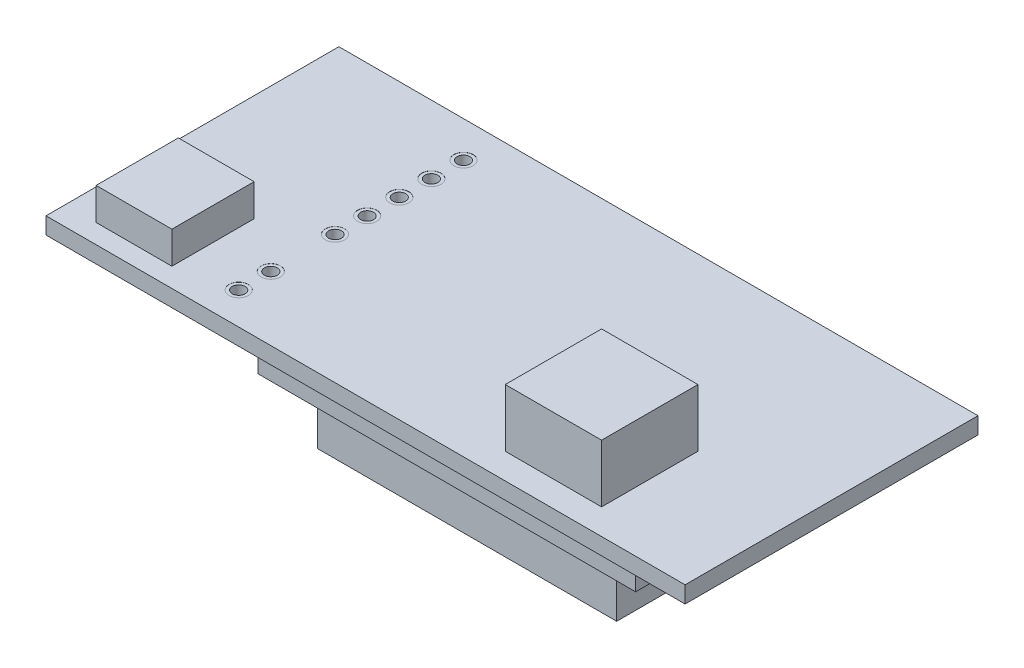
from build123d import *

# Parameters (mm, degrees)
SKETCH1_W           = 49.75
SKETCH1_H           = 22.8
BOSS_EXTRUDE1_DEPTH = 1.3
SKETCH2_W           = 7.5
SKETCH2_H           = 7.5
BOSS_EXTRUDE2_DEPTH = 4.5
SKETCH3_W           = 5.9
SKETCH3_H           = 6.4
BOSS_EXTRUDE3_DEPTH = 2.5
SKETCH4_W           = 29.4
SKETCH4_H           = 21.1
BOSS_EXTRUDE4_DEPTH = 1.95
SKETCH5_W           = 23.3
SKETCH5_H           = 20.25
BOSS_EXTRUDE5_DEPTH = 3.15
CUT_EXTRUDE1_REACH  = 29.971
SKETCH6_R           = 0.5
SKETCH7_R           = 0.75
CUT_EXTRUDE2_DEPTH  = 0.01
CUT_EXTRUDE3_START  = -0.01
SKETCH8_R           = 0.75
CUT_EXTRUDE3_DEPTH  = 0.01


with BuildPart() as part:
    # Sketch1 → Boss-Extrude1 (new body)
    with BuildSketch(Plane(origin=(0, 0, 0), x_dir=(1, 0, 0), z_dir=(0, 1, 0))):
        Rectangle(SKETCH1_W, SKETCH1_H)
    extrude(amount=BOSS_EXTRUDE1_DEPTH)

    # Sketch2 → Boss-Extrude2 (add)
    with BuildSketch(Plane(origin=(0, 1.3, 0), x_dir=(1, 0, 0), z_dir=(0, 1, 0))):
        with Locations((12.625, -5.65)):
            Rectangle(SKETCH2_W, SKETCH2_H)
    extrude(amount=BOSS_EXTRUDE2_DEPTH)

    # Sketch3 → Boss-Extrude3 (add)
    with BuildSketch(Plane(origin=(0, 1.3, 0), x_dir=(1, 0, 0), z_dir=(0, 1, 0))):
        with Locations((-19.525, -6.7)):
            Rectangle(SKETCH3_W, SKETCH3_H)
    extrude(amount=BOSS_EXTRUDE3_DEPTH)

    # Sketch4 → Boss-Extrude4 (add)
    with BuildSketch(Plane.XZ):
        with Locations((5.475, 0)):
            Rectangle(SKETCH4_W, SKETCH4_H)
    extrude(amount=BOSS_EXTRUDE4_DEPTH)

    # Sketch5 → Boss-Extrude5 (add)
    with BuildSketch(Plane.XZ.offset(1.95)):
        with Locations((6.625, 0)):
            Rectangle(SKETCH5_W, SKETCH5_H)
    extrude(amount=BOSS_EXTRUDE5_DEPTH)

    # Sketch6 → Cut-Extrude1 (cut, up to next)
    with BuildSketch(Plane.XZ, mode=Mode.PRIVATE) as cut_extrude1_sk1:
        with Locations(Location((-12.375, 8.9, 0), (0, 0, 270))):
            Circle(SKETCH6_R)
    cut_extrude1_tool1 = extrude(cut_extrude1_sk1.sketch, amount=-CUT_EXTRUDE1_REACH, mode=Mode.PRIVATE) & part.part
    # Sketch6 → Cut-Extrude1 (cut, up to next)
    with BuildSketch(Plane.XZ, mode=Mode.PRIVATE) as cut_extrude1_sk2:
        with Locations(Location((-12.375, 6.4, 0), (0, 0, 270))):
            Circle(SKETCH6_R)
    cut_extrude1_tool2 = extrude(cut_extrude1_sk2.sketch, amount=-CUT_EXTRUDE1_REACH, mode=Mode.PRIVATE) & part.part
    # Sketch6 → Cut-Extrude1 (cut, up to next)
    with BuildSketch(Plane.XZ, mode=Mode.PRIVATE) as cut_extrude1_sk3:
        with Locations(Location((-12.375, 1.4, 0), (0, 0, 270))):
            Circle(SKETCH6_R)
    cut_extrude1_tool3 = extrude(cut_extrude1_sk3.sketch, amount=-CUT_EXTRUDE1_REACH, mode=Mode.PRIVATE) & part.part
    # Sketch6 → Cut-Extrude1 (cut, up to next)
    with BuildSketch(Plane.XZ, mode=Mode.PRIVATE) as cut_extrude1_sk4:
        with Locations(Location((-12.375, -1.1, 0), (0, 0, 270))):
            Circle(SKETCH6_R)
    cut_extrude1_tool4 = extrude(cut_extrude1_sk4.sketch, amount=-CUT_EXTRUDE1_REACH, mode=Mode.PRIVATE) & part.part
    # Sketch6 → Cut-Extrude1 (cut, up to next)
    with BuildSketch(Plane.XZ, mode=Mode.PRIVATE) as cut_extrude1_sk5:
        with Locations(Location((-12.375, -3.6, 0), (0, 0, 270))):
            Circle(SKETCH6_R)
    cut_extrude1_tool5 = extrude(cut_extrude1_sk5.sketch, amount=-CUT_EXTRUDE1_REACH, mode=Mode.PRIVATE) & part.part
    # Sketch6 → Cut-Extrude1 (cut, up to next)
    with BuildSketch(Plane.XZ, mode=Mode.PRIVATE) as cut_extrude1_sk6:
        with Locations(Location((-12.375, -6.1, 0), (0, 0, 270))):
            Circle(SKETCH6_R)
    cut_extrude1_tool6 = extrude(cut_extrude1_sk6.sketch, amount=-CUT_EXTRUDE1_REACH, mode=Mode.PRIVATE) & part.part
    # Sketch6 → Cut-Extrude1 (cut, up to next)
    with BuildSketch(Plane.XZ, mode=Mode.PRIVATE) as cut_extrude1_sk7:
        with Locations(Location((-12.375, -8.6, 0), (0, 0, 270))):
            Circle(SKETCH6_R)
    cut_extrude1_tool7 = extrude(cut_extrude1_sk7.sketch, amount=-CUT_EXTRUDE1_REACH, mode=Mode.PRIVATE) & part.part
    add(cut_extrude1_tool1.solids().sort_by_distance((-12.375, 0, 8.9))[0], mode=Mode.SUBTRACT)
    add(cut_extrude1_tool2.solids().sort_by_distance((-12.375, 0, 6.4))[0], mode=Mode.SUBTRACT)
    add(cut_extrude1_tool3.solids().sort_by_distance((-12.375, 0, 1.4))[0], mode=Mode.SUBTRACT)
    add(cut_extrude1_tool4.solids().sort_by_distance((-12.375, 0, -1.1))[0], mode=Mode.SUBTRACT)
    add(cut_extrude1_tool5.solids().sort_by_distance((-12.375, 0, -3.6))[0], mode=Mode.SUBTRACT)
    add(cut_extrude1_tool6.solids().sort_by_distance((-12.375, 0, -6.1))[0], mode=Mode.SUBTRACT)
    add(cut_extrude1_tool7.solids().sort_by_distance((-12.375, 0, -8.6))[0], mode=Mode.SUBTRACT)

    # Sketch7 → Cut-Extrude2 (cut)
    with BuildSketch(Plane.XZ):
        with Locations(Location((-12.375, 8.9, 0), (0, 0, 270))):
            Circle(SKETCH7_R)
        with Locations(Location((-12.375, 6.4, 0), (0, 0, 270))):
            Circle(SKETCH7_R)
        with Locations(Location((-12.375, 1.4, 0), (0, 0, 270))):
            Circle(SKETCH7_R)
        with Locations(Location((-12.375, -1.1, 0), (0, 0, 270))):
            Circle(SKETCH7_R)
        with Locations(Location((-12.375, -3.6, 0), (0, 0, 270))):
            Circle(SKETCH7_R)
        with Locations(Location((-12.375, -6.1, 0), (0, 0, 270))):
            Circle(SKETCH7_R)
        with Locations(Location((-12.375, -8.6, 0), (0, 0, 270))):
            Circle(SKETCH7_R)
    extrude(amount=-CUT_EXTRUDE2_DEPTH, mode=Mode.SUBTRACT)

    # Sketch8 → Cut-Extrude3 (cut)
    with BuildSketch(Plane(origin=(0, 1.3, 0), x_dir=(1, 0, 0), z_dir=(0, 1, 0)).offset(CUT_EXTRUDE3_START)):
        with Locations(Location((-12.375, 8.6, 0), (0, 0, 90))):
            Circle(SKETCH8_R)
        with Locations(Location((-12.375, 6.1, 0), (0, 0, 90))):
            Circle(SKETCH8_R)
        with Locations(Location((-12.375, 3.6, 0), (0, 0, 90))):
            Circle(SKETCH8_R)
        with Locations(Location((-12.375, 1.1, 0), (0, 0, 90))):
            Circle(SKETCH8_R)
        with Locations(Location((-12.375, -1.4, 0), (0, 0, 90))):
            Circle(SKETCH8_R)
        with Locations(Location((-12.375, -6.4, 0), (0, 0, 90))):
            Circle(SKETCH8_R)
        with Locations(Location((-12.375, -8.9, 0), (0, 0, 90))):
            Circle(SKETCH8_R)
    extrude(amount=CUT_EXTRUDE3_DEPTH, mode=Mode.SUBTRACT)


solid = part.part
